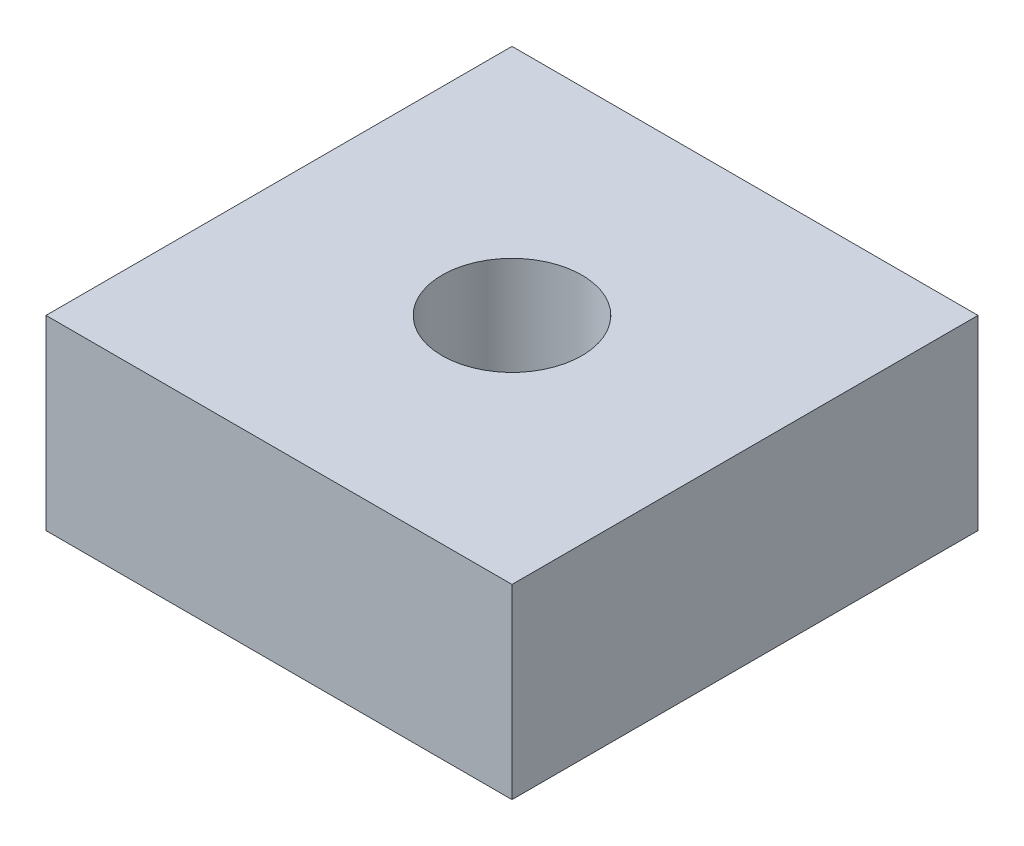
from build123d import *

# Parameters (mm, degrees)
SKETCH1_W           = 10
SKETCH1_H           = 10
SKETCH1_R           = 1.5
BOSS_EXTRUDE1_DEPTH = 4


with BuildPart() as part:
    # Sketch1 → Boss-Extrude1 (new body)
    with BuildSketch(Plane(origin=(0, 0, 0), x_dir=(1, 0, 0), z_dir=(0, 1, 0))):
        Rectangle(SKETCH1_W, SKETCH1_H)
        with Locations(Location((0, 0, 0), (0, 0, 270))):
            Circle(SKETCH1_R, mode=Mode.SUBTRACT)
    extrude(amount=BOSS_EXTRUDE1_DEPTH)


solid = part.part
